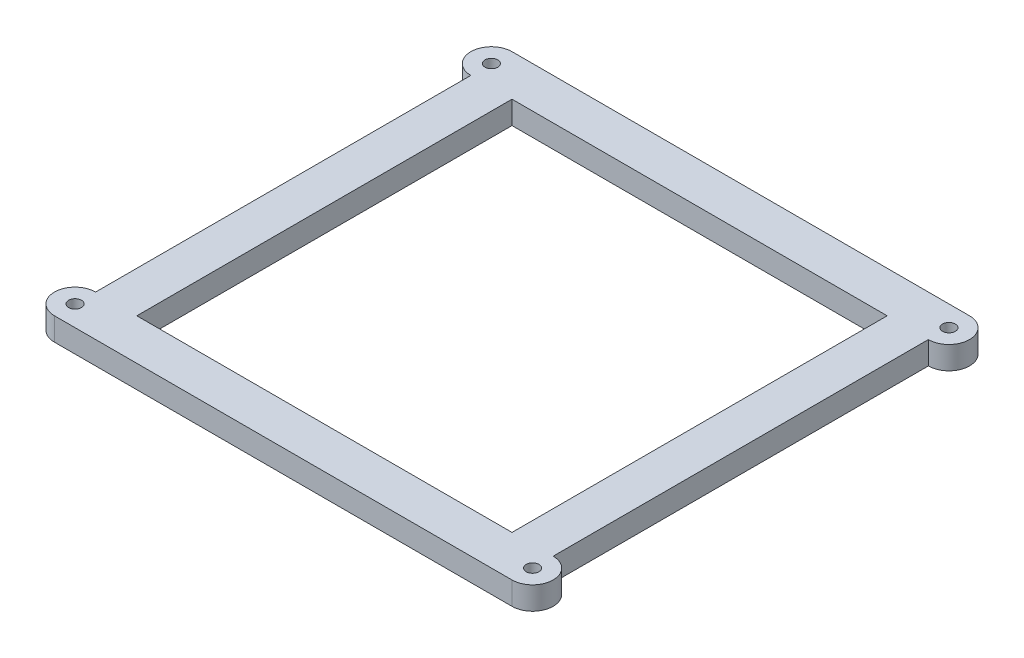
from build123d import *

# Parameters (mm, degrees)
SKETCH1_W                = 52.07
SKETCH1_H                = 52.07
BOSS_EXTRUDE1_DEPTH      = 3.175
M2_CLEARANCE_HOLE1_D     = 2.2
M2_CLEARANCE_HOLE1_DEPTH = 3.048
M2_CLEARANCE_HOLE1_TIP   = 0.660946681


with BuildPart() as part:
    # Sketch1 → Boss-Extrude1 (new body)
    with BuildSketch(Plane(origin=(0, 0, 0), x_dir=(1, 0, 0), z_dir=(0, 1, 0))):
        with BuildLine():
            Line((0, 0), (63.5, 0))
            ThreePointArc((63.5, 0), (66.3575, 2.8575), (63.5, 5.715))
            Line((63.5, 5.715), (63.5, 57.785))
            ThreePointArc((63.5, 57.785), (66.3575, 60.6425), (63.5, 63.5))
            Line((63.5, 63.5), (0, 63.5))
            ThreePointArc((0, 63.5), (-2.8575, 60.6425), (0, 57.785))
            Line((0, 57.785), (0, 5.715))
            ThreePointArc((0, 5.715), (-2.8575, 2.8575), (0, 0))
        make_face()
        with Locations((31.75, 31.75)):
            Rectangle(SKETCH1_W, SKETCH1_H, mode=Mode.SUBTRACT)
    extrude(amount=BOSS_EXTRUDE1_DEPTH)

    # M2 Clearance Hole1
    with Locations(Plane(origin=(0, 0, 0), x_dir=(-1, 0, 0), z_dir=(0, -1, 0))):
        with Locations((-63.5, 60.6425), (0, 60.6425), (0, 2.8575), (-63.5, 2.8575)):
            Hole(M2_CLEARANCE_HOLE1_D / 2, depth=M2_CLEARANCE_HOLE1_DEPTH)
            with Locations((0, 0, -(M2_CLEARANCE_HOLE1_DEPTH + M2_CLEARANCE_HOLE1_TIP / 2))):  # 118° drill point
                Cone(0, M2_CLEARANCE_HOLE1_D / 2, M2_CLEARANCE_HOLE1_TIP, mode=Mode.SUBTRACT)


solid = part.part
